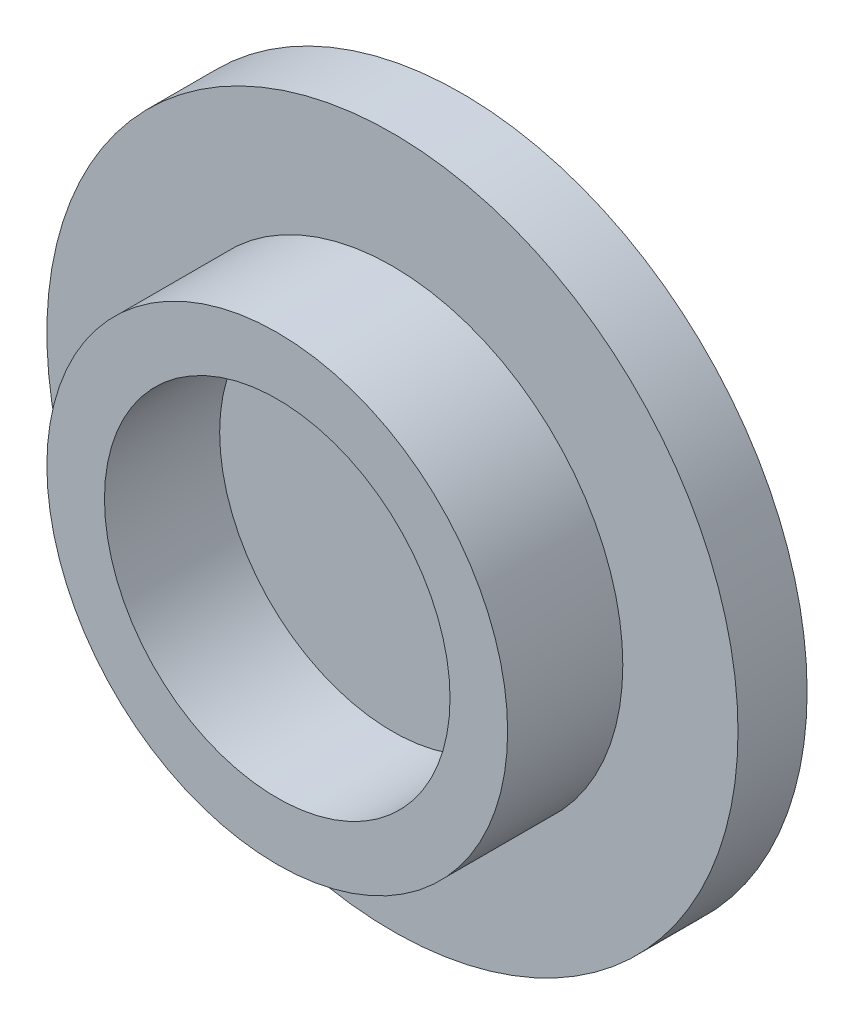
from build123d import *

# Parameters (mm, degrees)
SKETCH1_R           = 15
BOSS_EXTRUDE1_DEPTH = 3
SKETCH2_R           = 10
SKETCH2_R_2         = 7.5
BOSS_EXTRUDE2_DEPTH = 5


with BuildPart() as part:
    # Sketch1 → Boss-Extrude1 (new body)
    with BuildSketch(Plane.XY):
        Circle(SKETCH1_R)
    extrude(amount=BOSS_EXTRUDE1_DEPTH)

    # Sketch2 → Boss-Extrude2 (add)
    with BuildSketch(Plane.XY.offset(3)):
        Circle(SKETCH2_R)
        Circle(SKETCH2_R_2, mode=Mode.SUBTRACT)
    extrude(amount=BOSS_EXTRUDE2_DEPTH)


solid = part.part
